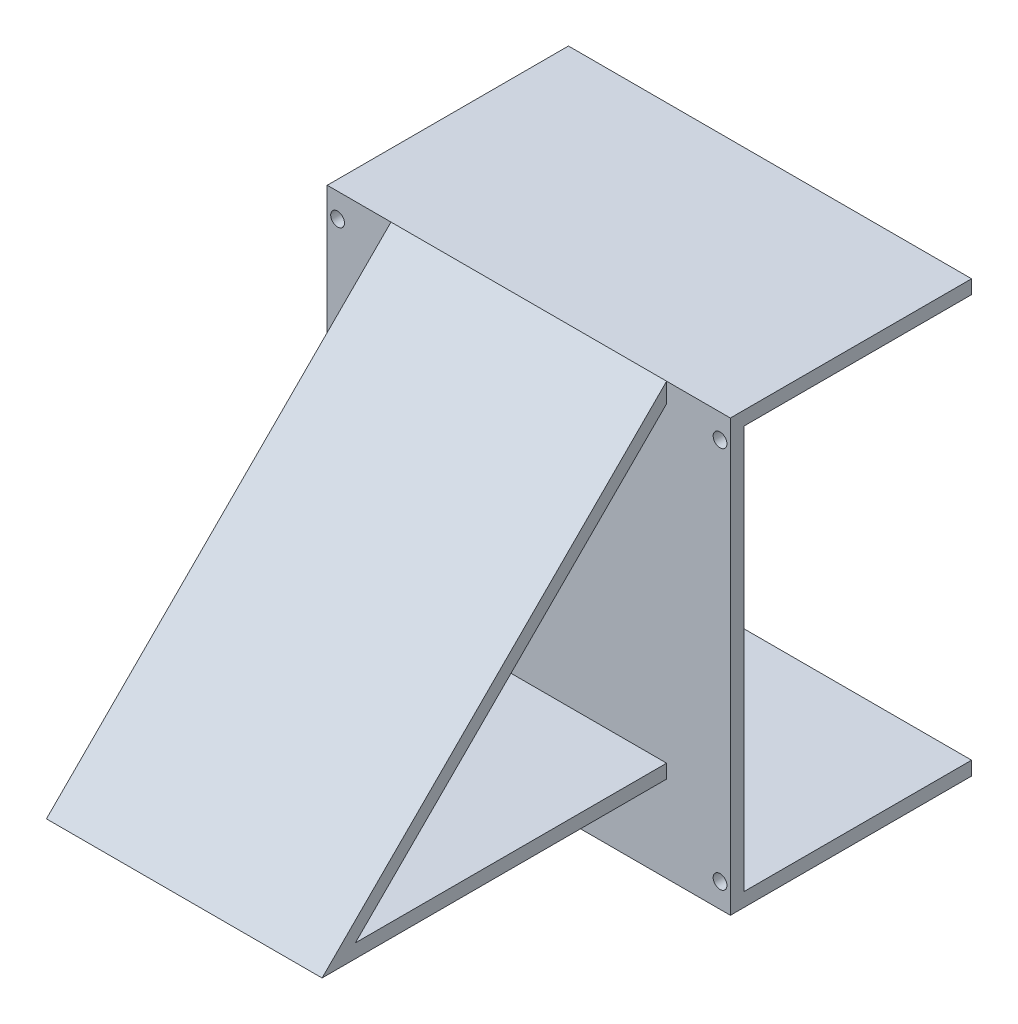
from build123d import *

# Parameters (mm, degrees)
SKIZZE1_W                       = 117
SKIZZE1_H                       = 125
AUFSATZ_LINEAR_AUSTRAGEN1_DEPTH = 4
SKIZZE2_W                       = 80
SKIZZE2_H                       = 100
AUFSATZ_LINEAR_AUSTRAGEN2_DEPTH = 100
SCHNITT_LINEAR_AUSTRAGEN1_DEPTH = 100
SCHNITT_LINEAR_AUSTRAGEN2_DEPTH = 100
SKIZZE5_W                       = 117
SKIZZE5_H                       = 4
AUFSATZ_LINEAR_AUSTRAGEN3_DEPTH = 66
SKIZZE6_R                       = 2
SCHNITT_LINEAR_AUSTRAGEN3_DEPTH = 70


with BuildPart() as part:
    # Skizze1 → Aufsatz-Linear austragen1 (new body)
    with BuildSketch(Plane.XY):
        with Locations((58.5, 62.5)):
            Rectangle(SKIZZE1_W, SKIZZE1_H)
    extrude(amount=AUFSATZ_LINEAR_AUSTRAGEN1_DEPTH)

    # Skizze2 → Aufsatz-Linear austragen2 (add)
    with BuildSketch(Plane.XY.offset(4)):
        with Locations((58.5, 75)):
            Rectangle(SKIZZE2_W, SKIZZE2_H)
    extrude(amount=AUFSATZ_LINEAR_AUSTRAGEN2_DEPTH)

    # Skizze3 → Schnitt-Linear austragen1 (cut)
    with BuildSketch(Plane.ZY.offset(-18.5)):
        Polygon((104, 25), (104, 125), (4, 125), align=None)
    extrude(amount=-SCHNITT_LINEAR_AUSTRAGEN1_DEPTH, mode=Mode.SUBTRACT)

    # Skizze4 → Schnitt-Linear austragen2 (cut)
    with BuildSketch(Plane.ZY.offset(-18.5)):
        Polygon((4, 119.343145751), (94.343145751, 29), (4, 29), align=None)
    extrude(amount=-SCHNITT_LINEAR_AUSTRAGEN2_DEPTH, mode=Mode.SUBTRACT)

    # Skizze5 → Aufsatz-Linear austragen3 (add)
    with BuildSketch(Plane(origin=(0, 0, 0), x_dir=(-1, 0, 0), z_dir=(0, 0, -1))):
        with Locations((-58.5, 123)):
            Rectangle(SKIZZE5_W, SKIZZE5_H)
        with Locations((-58.5, 2)):
            Rectangle(SKIZZE5_W, SKIZZE5_H)
    extrude(amount=AUFSATZ_LINEAR_AUSTRAGEN3_DEPTH)

    # Skizze6 → Schnitt-Linear austragen3 (cut)
    with BuildSketch(Plane(origin=(0, 0, 0), x_dir=(-1, 0, 0), z_dir=(0, 0, -1))):
        with Locations((-114, 118)):
            Circle(SKIZZE6_R)
        with Locations((-3, 118)):
            Circle(SKIZZE6_R)
        with Locations((-3, 7)):
            Circle(SKIZZE6_R)
        with Locations((-114, 7)):
            Circle(SKIZZE6_R)
    extrude(amount=-SCHNITT_LINEAR_AUSTRAGEN3_DEPTH, mode=Mode.SUBTRACT)


solid = part.part
